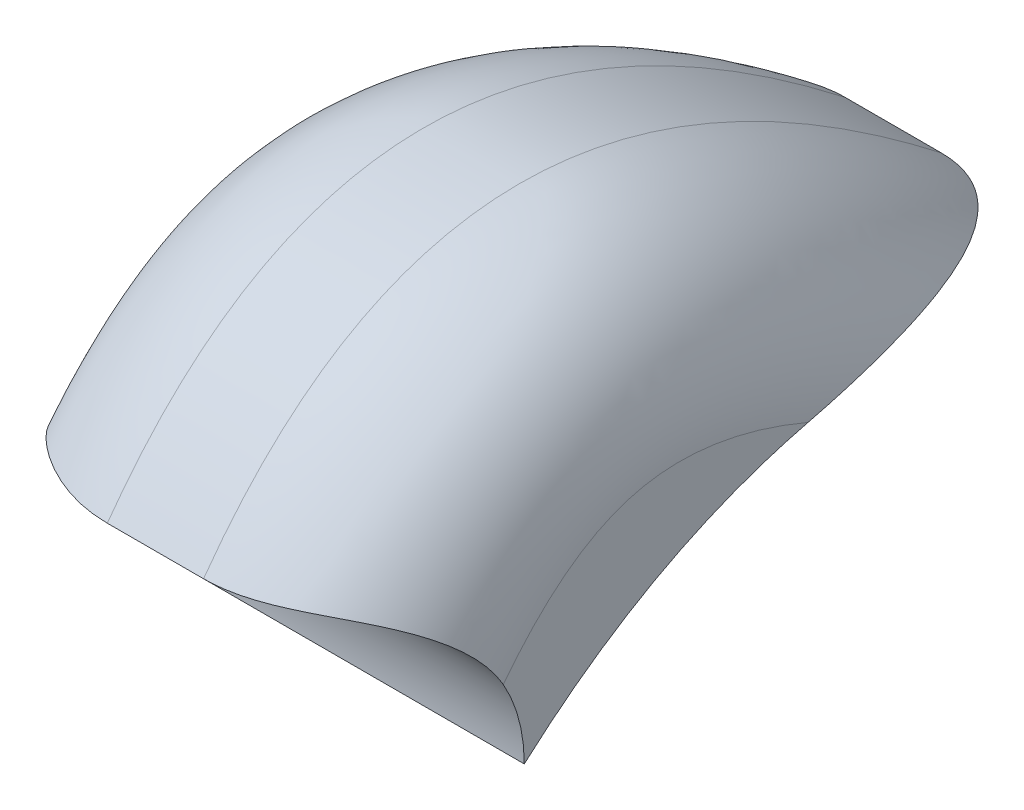
from build123d import *

# Parameters (mm, degrees)
BOSS_EXTRUDE1_DEPTH = 33.02
FILLET1_R           = 12.7
SHELL1_T            = -0.508


with BuildPart() as part:
    # Sketch1 → Boss-Extrude1 (new body)
    with BuildSketch(Plane(origin=(0, 0, 0), x_dir=(0, 0, -1), z_dir=(1, 0, 0))):
        with BuildLine():
            ThreePointArc((12.7, 0), (8.980256121, 8.980256121), (0, 12.7))
            add(Edge.make_bspline(
                [(0, 12.7), (20.864402494, 41.884638656), (58.42, 12.7)],
                knots=[0, 0, 0, 1, 1, 1], degree=2))
            add(Edge.make_bspline(
                [(12.7, 0), (31.891163141, 17.27124085), (58.42, 12.7)],
                knots=[0, 0, 0, 1, 1, 1], degree=2))
        make_face()
    extrude(amount=BOSS_EXTRUDE1_DEPTH)

    # Fillet1
    fillet1_edges = [part.edges().sort_by_distance(p)[0] for p in [
        (0, 27.096981156, -28.472641607),
        (33.02, 27.096981156, -28.472641607),
    ]]
    fillet(fillet1_edges, radius=FILLET1_R)

    # Shell1
    shell1_openings = [part.faces().sort_by_distance(p)[0] for p in [
        (16.58654835, 6.565370086, -33.984689517),
    ]]
    offset(amount=SHELL1_T, openings=shell1_openings, kind=Kind.INTERSECTION)


solid = part.part
